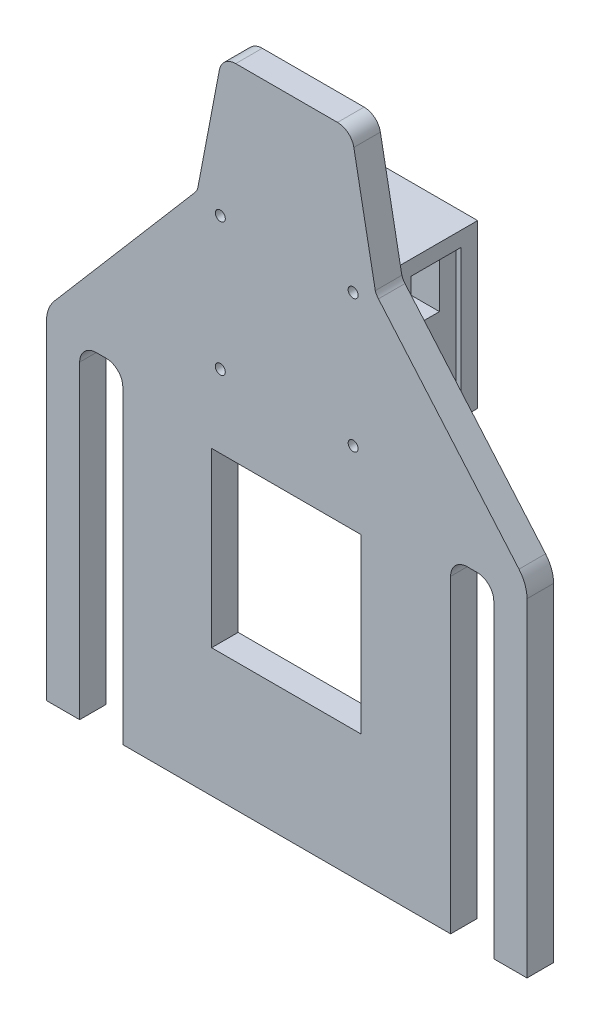
from build123d import *

# Parameters (mm, degrees)
BOSS_EXTRUDE1_DEPTH    = 8
SKETCH2_W              = 45
SKETCH2_H              = 52
CUT_EXTRUDE1_DEPTH     = 342.206659287
SPLIT1_SURFACE_1_BACK  = 343.199
SPLIT1_SURFACE_1_DEPTH = 686.398
SPLIT1_SURFACE_2_BACK  = 343.199
SPLIT1_SURFACE_2_DEPTH = 686.398
SKETCH5_R              = 2.5
CUT_EXTRUDE6_DEPTH     = 5.2
SKETCH4_R              = 2.5
CUT_EXTRUDE7_DEPTH     = 5.2
SKETCH6_R              = 1.5
CUT_EXTRUDE8_DEPTH     = 342.206659287
SKETCH7_W              = 49
SKETCH7_H              = 49
SKETCH7_W_2            = 18
SKETCH7_H_2            = 18
BOSS_EXTRUDE2_DEPTH    = 15
SKETCH8_W              = 49
SKETCH8_H              = 49
SKETCH8_R              = 1.5
BOSS_EXTRUDE3_DEPTH    = 10
SKETCH9_W              = 15
SKETCH9_H              = 40
CUT_EXTRUDE9_DEPTH     = 1.5
SKETCH11_W             = 15
SKETCH11_H             = 40
CUT_EXTRUDE10_DEPTH    = 1.5


with BuildPart() as part:
    # Sketch1 → Boss-Extrude1 (new body)
    with BuildSketch(Plane.XY):
        with BuildLine():
            Line((70, 309.985818768), (85.299227191, 309.985818768))
            ThreePointArc((85.299227191, 309.985818768), (88.489017574, 308.836174247), (90.211957942, 305.915913694))
            Line((90.211957942, 305.915913694), (96.672728921, 271.790334282))
            ThreePointArc((96.672728921, 271.790334282), (97.06575438, 270.906904614), (97.621470019, 270.115641625))
            Line((97.621470019, 270.115641625), (139.950460317, 220.786053348))
            ThreePointArc((139.950460317, 220.786053348), (141.739336996, 217.746026552), (142.361429131, 214.274017901))
            Line((142.361429131, 214.274017901), (142.361429131, 30.859943174))
            ThreePointArc((142.361429131, 30.859943174), (140.896963037, 27.324409268), (137.361429131, 25.859943174))
            Line((137.361429131, 25.859943174), (114.717190871, 25.782318449))
            ThreePointArc((114.717190871, 25.782318449), (112.681998989, 25.341726514), (111.002773989, 24.110332733))
            Line((111.002773989, 24.110332733), (89.38285929, 0))
            Line((89.38285929, 0), (50.5, 0))
            Line((50.5, 0), (28.997226011, 24.110332733))
            ThreePointArc((28.997226011, 24.110332733), (27.318001011, 25.341726514), (25.282809129, 25.782318449))
            Line((25.282809129, 25.782318449), (2.638570869, 25.859943174))
            ThreePointArc((2.638570869, 25.859943174), (-0.896963037, 27.324409268), (-2.361429131, 30.859943174))
            Line((-2.361429131, 30.859943174), (-2.361429131, 214.274017901))
            ThreePointArc((-2.361429131, 214.274017901), (-1.739336996, 217.746026552), (0.049539683, 220.786053348))
            Line((0.049539683, 220.786053348), (42.261389271, 270.115641625))
            ThreePointArc((42.261389271, 270.115641625), (42.81710491, 270.906904614), (43.210130369, 271.790334282))
            Line((43.210130369, 271.790334282), (49.724618218, 305.923183314))
            ThreePointArc((49.724618218, 305.923183314), (51.449026762, 308.838533573), (54.635967087, 309.985818768))
            Line((54.635967087, 309.985818768), (70, 309.985818768))
        make_face()
        with BuildLine():
            Line((7.638570869, 35.492492662), (20.638570869, 35.492492662))
            Line((20.638570869, 35.492492662), (20.638570869, 208.625959477))
            ThreePointArc((20.638570869, 208.625959477), (19.174104775, 212.161493383), (15.638570869, 213.625959477))
            Line((15.638570869, 213.625959477), (12.638570869, 213.625959477))
            ThreePointArc((12.638570869, 213.625959477), (9.103036963, 212.161493383), (7.638570869, 208.625959477))
            Line((7.638570869, 208.625959477), (7.638570869, 35.492492662))
        make_face(mode=Mode.SUBTRACT)
        with BuildLine():
            Line((127.361429131, 35.492492662), (124.361429131, 35.492492662))
            ThreePointArc((124.361429131, 35.492492662), (120.825895225, 36.956958756), (119.361429131, 40.492492662))
            Line((119.361429131, 40.492492662), (119.361429131, 208.625959477))
            ThreePointArc((119.361429131, 208.625959477), (120.825895225, 212.161493383), (124.361429131, 213.625959477))
            Line((124.361429131, 213.625959477), (127.361429131, 213.625959477))
            ThreePointArc((127.361429131, 213.625959477), (130.896963037, 212.161493383), (132.361429131, 208.625959477))
            Line((132.361429131, 208.625959477), (132.361429131, 40.492492662))
            ThreePointArc((132.361429131, 40.492492662), (130.896963037, 36.956958756), (127.361429131, 35.492492662))
        make_face(mode=Mode.SUBTRACT)
    extrude(amount=BOSS_EXTRUDE1_DEPTH)

    # Sketch2 → Cut-Extrude1 (cut, through all)
    with BuildSketch(Plane.XY.offset(8)):
        with Locations((69.88285929, 180.008918923)):
            Rectangle(SKETCH2_W, SKETCH2_H)
    extrude(amount=-CUT_EXTRUDE1_DEPTH, mode=Mode.SUBTRACT)


with BuildPart() as body_2:
    # Split1: the piece behind the surface
    add(part.part)
    # Split1 surface: a surface, the sketch's curves swept straight by 686.398 mm
    with BuildLine(Plane(origin=(0, 0, 0), x_dir=(-1, 0, 0), z_dir=(0, 0, -1)).offset(-SPLIT1_SURFACE_1_BACK), mode=Mode.PRIVATE) as split1_surface_1_path:
        Line((-142.361429131, 115.359943174), (2.361429131, 115.359943174))
    split1_surface_1 = Shell.extrude(split1_surface_1_path.wire(), (0 * SPLIT1_SURFACE_1_DEPTH, 0 * SPLIT1_SURFACE_1_DEPTH, -1 * SPLIT1_SURFACE_1_DEPTH))
    split(bisect_by=split1_surface_1, keep=Keep.BOTTOM)

    # Sketch5 → Cut-Extrude6 (cut)
    with BuildSketch(Plane(origin=(0, 115.359943174, -115.359943174), x_dir=(1, 0, 0), z_dir=(0, -1, 0))):
        with Locations(Location((70, 119.359943174, 0), (0, 0, 270))):
            Circle(SKETCH5_R)
        with Locations(Location((40, 119.359943174, 0), (0, 0, 270))):
            Circle(SKETCH5_R)
        with Locations(Location((2.638570869, 119.359943174, 0), (0, 0, 270))):
            Circle(SKETCH5_R)
    extrude(amount=CUT_EXTRUDE6_DEPTH, mode=Mode.SUBTRACT)


with BuildPart() as part_1:
    add(part.part)

    # Split1: split by a surface, the side it looks to stays
    # Split1 surface: a surface, the sketch's curves swept straight by 686.398 mm
    with BuildLine(Plane(origin=(0, 0, 0), x_dir=(-1, 0, 0), z_dir=(0, 0, -1)).offset(-SPLIT1_SURFACE_2_BACK), mode=Mode.PRIVATE) as split1_surface_2_path:
        Line((-142.361429131, 115.359943174), (2.361429131, 115.359943174))
    split1_surface_2 = Shell.extrude(split1_surface_2_path.wire(), (0 * SPLIT1_SURFACE_2_DEPTH, 0 * SPLIT1_SURFACE_2_DEPTH, -1 * SPLIT1_SURFACE_2_DEPTH))
    split(bisect_by=split1_surface_2, keep=Keep.TOP)

    # Sketch4 → Cut-Extrude7 (cut)
    with BuildSketch(Plane(origin=(0, 115.359943174, 0), x_dir=(-1, 0, 0), z_dir=(0, -1, 0))):
        with Locations(Location((-70, -4, 0), (0, 0, 270))):
            Circle(SKETCH4_R)
        with Locations(Location((-40, -4, 0), (0, 0, 270))):
            Circle(SKETCH4_R)
        with Locations(Location((-100, -4, 0), (0, 0, 270))):
            Circle(SKETCH4_R)
        with Locations(Location((-137.361429131, -4, 0), (0, 0, 90))):
            Circle(SKETCH4_R)
        with Locations(Location((-2.638570869, -4, 0), (0, 0, 270))):
            Circle(SKETCH4_R)
    extrude(amount=-CUT_EXTRUDE7_DEPTH, mode=Mode.SUBTRACT)

    # Sketch6 → Cut-Extrude8 (cut, through all)
    with BuildSketch(Plane.XY.offset(8)):
        with Locations((50.000130369, 267.980334282)):
            Circle(SKETCH6_R)
        with Locations((90.000130369, 267.980334282)):
            Circle(SKETCH6_R)
        with Locations((90.000130369, 227.980334282)):
            Circle(SKETCH6_R)
        with Locations((50.000130369, 227.980334282)):
            Circle(SKETCH6_R)
    extrude(amount=-CUT_EXTRUDE8_DEPTH, mode=Mode.SUBTRACT)

    # Sketch7 → Boss-Extrude2 (add)
    with BuildSketch(Plane(origin=(0, 0, 0), x_dir=(-1, 0, 0), z_dir=(0, 0, -1))):
        with Locations((-70.000130369, 247.980334282)):
            Rectangle(SKETCH7_W, SKETCH7_H)
        with Locations((-56.000130369, 261.980334282)):
            Rectangle(SKETCH7_W_2, SKETCH7_H_2, mode=Mode.SUBTRACT)
        with Locations((-84.000130369, 261.980334282)):
            Rectangle(SKETCH7_W_2, SKETCH7_H_2, mode=Mode.SUBTRACT)
        with Locations((-84.000130369, 233.980334282)):
            Rectangle(SKETCH7_W_2, SKETCH7_H_2, mode=Mode.SUBTRACT)
        with Locations((-56.000130369, 233.980334282)):
            Rectangle(SKETCH7_W_2, SKETCH7_H_2, mode=Mode.SUBTRACT)
    extrude(amount=BOSS_EXTRUDE2_DEPTH)

    # Sketch8 → Boss-Extrude3 (add)
    with BuildSketch(Plane(origin=(0, 0, -15), x_dir=(-1, 0, 0), z_dir=(0, 0, -1))):
        with Locations((-70.000130369, 247.980334282)):
            Rectangle(SKETCH8_W, SKETCH8_H)
        with Locations(Location((-50.000130369, 267.980334282, 0), (0, 0, 180))):
            Circle(SKETCH8_R, mode=Mode.SUBTRACT)
        with Locations(Location((-90.000130369, 267.980334282, 0), (0, 0, 180))):
            Circle(SKETCH8_R, mode=Mode.SUBTRACT)
        with Locations(Location((-50.000130369, 227.980334282, 0), (0, 0, 180))):
            Circle(SKETCH8_R, mode=Mode.SUBTRACT)
        with Locations(Location((-90.000130369, 227.980334282, 0), (0, 0, 180))):
            Circle(SKETCH8_R, mode=Mode.SUBTRACT)
    extrude(amount=BOSS_EXTRUDE3_DEPTH)

    # Sketch9 → Cut-Extrude9 (cut)
    with BuildSketch(Plane.ZY.offset(-45.500130369)):
        with Locations((-12.5, 247.980334282)):
            Rectangle(SKETCH9_W, SKETCH9_H)
    extrude(amount=-CUT_EXTRUDE9_DEPTH, mode=Mode.SUBTRACT)

    # Sketch11 → Cut-Extrude10 (cut)
    with BuildSketch(Plane(origin=(94.500130369, 0, 0), x_dir=(0, 0, -1), z_dir=(1, 0, 0))):
        with Locations((12.5, 247.980334282)):
            Rectangle(SKETCH11_W, SKETCH11_H)
    extrude(amount=-CUT_EXTRUDE10_DEPTH, mode=Mode.SUBTRACT)


solid = part_1.part
